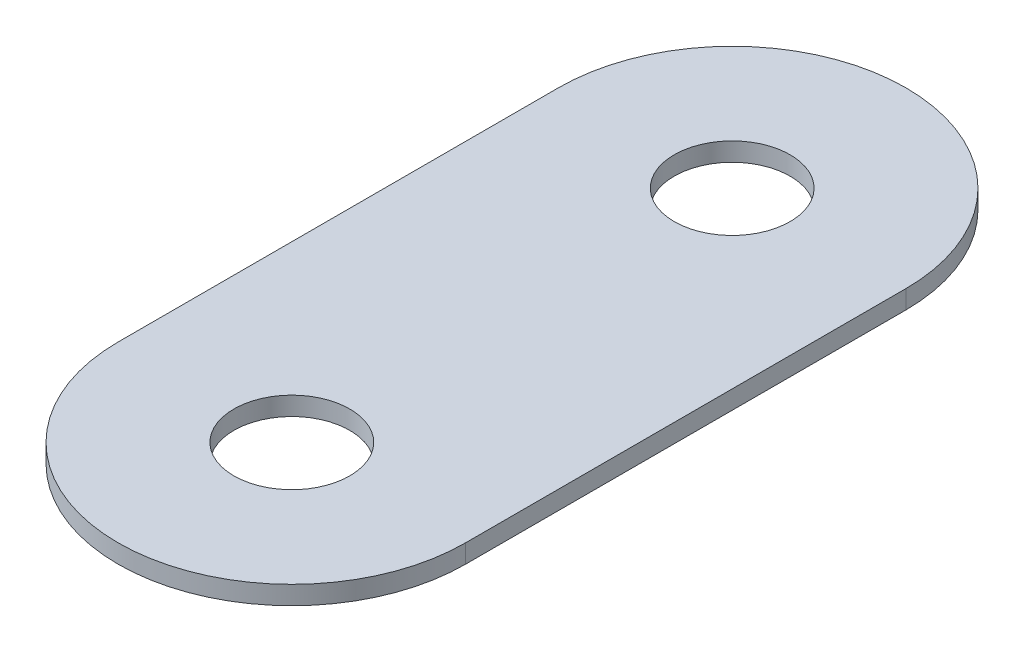
from build123d import *

# Parameters (mm, degrees)
BOSS_EXTRUDE2_DEPTH     = 0.8
CUT_EXTRUDE2_DEPTH      = 38.170418346
CUT_EXTRUDE2_DEPTH_BACK = 38.170418346
SKETCH7_R               = 5


with BuildPart() as part:
    # Sketch6 → Boss-Extrude2 (new, symmetric)
    with BuildSketch(Plane(origin=(0, 0, 0), x_dir=(1, 0, 0), z_dir=(0, 1, 0))):
        with BuildLine():
            Line((-15, 19), (-15, -19))
            ThreePointArc((-15, -19), (0, -34), (15, -19))
            Line((15, -19), (15, 19))
            ThreePointArc((15, 19), (0, 34), (-15, 19))
        make_face()
    extrude(amount=BOSS_EXTRUDE2_DEPTH, both=True)

    # Sketch7 → Cut-Extrude2 (cut, two sides: drawn at the far end of the back side and taken through both)
    with BuildSketch(Plane(origin=(0, 0, 0), x_dir=(1, 0, 0), z_dir=(0, 1, 0)).offset(-CUT_EXTRUDE2_DEPTH_BACK)):
        with Locations(Location((0, 19, 0), (0, 0, 270))):
            Circle(SKETCH7_R)
        with Locations(Location((0, -19, 0), (0, 0, 270))):
            Circle(SKETCH7_R)
    extrude(amount=CUT_EXTRUDE2_DEPTH + CUT_EXTRUDE2_DEPTH_BACK, mode=Mode.SUBTRACT)


solid = part.part
